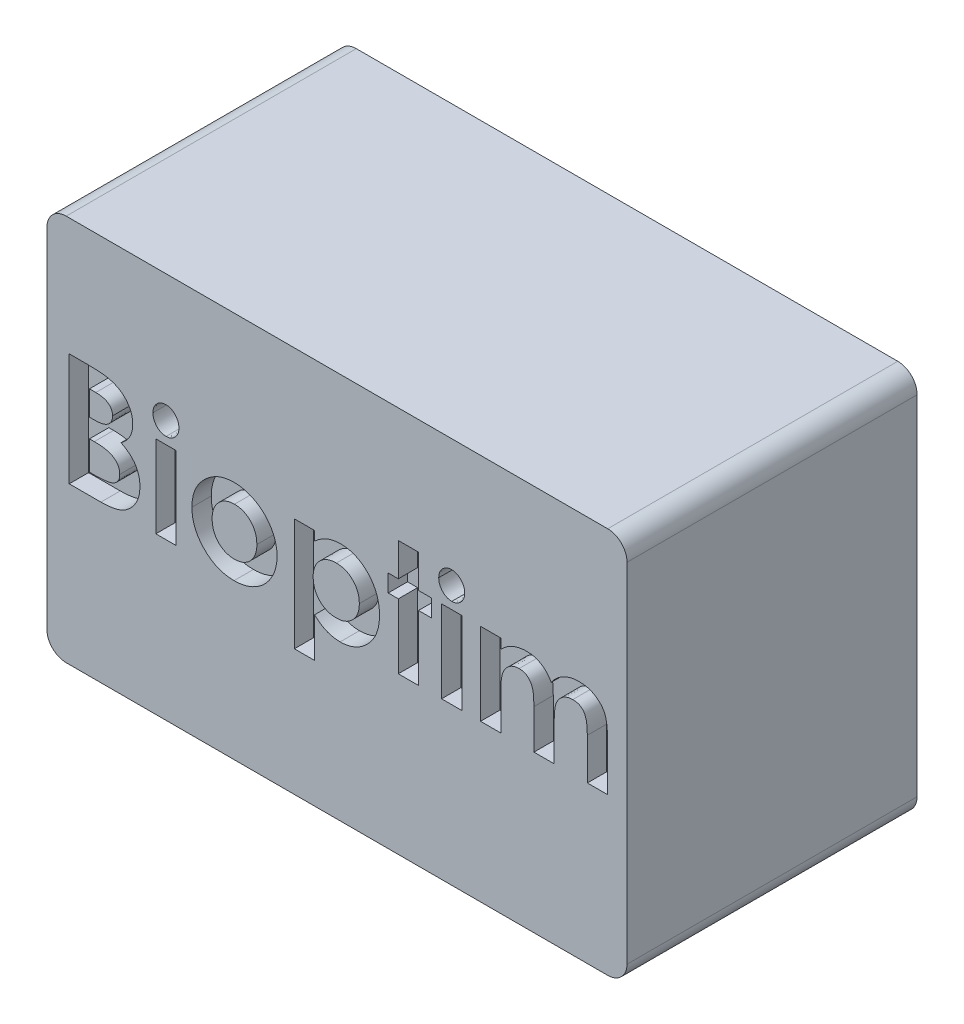
from build123d import *

# Parameters (mm, degrees)
ESQUISSE1_W             = 300
ESQUISSE1_H             = 200
BOSS_EXTRU_1_DEPTH      = 75
ESQUISSE3_W             = 10.447649573
ESQUISSE3_H             = 42.536858974
ESQUISSE3_W_2           = 10.447649572
ENL_V_MAT_EXTRU_1_DEPTH = 10
CONG_1_R                = 10


with BuildPart() as part:
    # Esquisse1 → Boss.-Extru.1 (new, symmetric)
    with BuildSketch(Plane.XY):
        Rectangle(ESQUISSE1_W, ESQUISSE1_H)
    extrude(amount=BOSS_EXTRU_1_DEPTH, both=True)

    # Esquisse3 → Enlèv. mat.-Extru.1 (cut)
    # profile 1 of 9: a face of its own
    with BuildSketch(Plane.XY.offset(75)):
        with BuildLine():
            Line((-138.431356838, -19.095532702), (-138.431356838, 39.112800631))
            Line((-138.431356838, 39.112800631), (-129.103098291, 39.112800631))
            add(Edge.make_bspline(
                [(-129.103098291, 39.112800631), (-128.450061865, 39.112875159), (-127.186448763, 39.113019369), (-125.363384829, 39.048999349), (-123.672646993, 38.966182281), (-122.119615837, 38.87352924), (-120.701647996, 38.713869539), (-119.42089972, 38.545605655), (-118.274812067, 38.342689781), (-117.566248349, 38.160667955), (-117.23288929, 38.075031868)],
                knots=[0, 0, 0, 0, 1.311965854, 2.538629056, 3.664479157, 4.713267157, 5.663616078, 6.530575999, 7.308677837, 8, 8, 8, 8], degree=3))
            add(Edge.make_bspline(
                [(-117.23288929, 38.075031868), (-116.795154999, 37.954240641), (-115.936179796, 37.717209477), (-114.705853187, 37.238514798), (-113.538716777, 36.706411722), (-112.436195609, 36.099381632), (-111.4050596, 35.410095973), (-110.44922742, 34.633084367), (-109.548084132, 33.799536027), (-108.733627279, 32.886220196), (-107.997492476, 31.921132838), (-107.357923314, 30.904526833), (-106.802219686, 29.85194675), (-106.357511227, 28.750146568), (-106.022431758, 27.604200376), (-105.777356032, 26.419001541), (-105.618513776, 25.190799803), (-105.603505266, 24.355214016), (-105.595886752, 23.931059846)],
                knots=[0, 0, 0, 0, 1.099996261, 2.158545794, 3.195537121, 4.207578794, 5.205712374, 6.197378256, 7.190519799, 8.17788031, 9.159561366, 10.129234751, 11.085776129, 12.040971148, 13.00380137, 13.975669004, 14.972423361, 16, 16, 16, 16], degree=3))
            add(Edge.make_bspline(
                [(-105.595886752, 23.931059846), (-105.615806903, 23.386133071), (-105.655017273, 22.313511668), (-105.905495783, 20.738024887), (-106.375182017, 19.248963429), (-106.98975503, 17.818884453), (-107.825382187, 16.453122164), (-108.886467064, 15.152325944), (-110.155823562, 13.876442327), (-111.129490068, 13.111636162), (-111.635934161, 12.713828943)],
                knots=[0, 0, 0, 0, 0.986156485, 1.941127874, 2.875419072, 3.804401753, 4.751181392, 5.761612777, 6.835722519, 8, 8, 8, 8], degree=3))
            add(Edge.make_bspline(
                [(-111.635934161, 12.713828943), (-111.225536164, 12.504324325), (-110.420859235, 12.093543731), (-109.278454396, 11.418343059), (-108.220712219, 10.700181512), (-107.242890107, 9.953508787), (-106.365499, 9.146672347), (-105.552309945, 8.326163216), (-104.843441468, 7.444969631), (-104.209549912, 6.534499011), (-103.658581674, 5.581567635), (-103.178749095, 4.58778479), (-102.773451727, 3.549755498), (-102.430235433, 2.472762486), (-102.174264629, 1.353101403), (-102.007366222, 0.190371812), (-101.87957837, -1.011460789), (-101.869637676, -1.830119144), (-101.864583333, -2.246365701)],
                knots=[0, 0, 0, 0, 1.164658916, 2.283573913, 3.35186032, 4.395461096, 5.390182219, 6.362969632, 7.312859996, 8.245001507, 9.165155236, 10.092416118, 11.032087915, 11.979892451, 12.947605196, 13.931445124, 14.948243989, 16, 16, 16, 16], degree=3))
            add(Edge.make_bspline(
                [(-101.864583333, -2.246365701), (-101.897382637, -3.041372826), (-101.962111932, -4.610316199), (-102.435380953, -6.913885403), (-103.255879055, -9.097877942), (-104.357638814, -11.153613695), (-105.715218817, -13.021582486), (-107.276046511, -14.65790693), (-109.02440794, -16.043019245), (-110.637482675, -16.977862604), (-112.032665291, -17.605229917), (-113.188268984, -17.993107953), (-114.429362856, -18.352437579), (-115.778680765, -18.604766262), (-117.211761418, -18.835725219), (-118.742577442, -18.978324063), (-120.368267769, -19.074959786), (-121.484862159, -19.088536421), (-122.060263088, -19.095532702)],
                knots=[0, 0, 0, 0, 1.284142165, 2.534249414, 3.780121997, 5.041676246, 6.291546858, 7.49970053, 8.684500223, 9.883330709, 10.50184324, 11.153274765, 11.851151195, 12.587658647, 13.369265475, 14.195992086, 15.070362669, 16, 16, 16, 16], degree=3))
            Line((-122.060263088, -19.095532702), (-138.431356838, -19.095532702))
        make_face()
        with BuildLine():
            Line((-127.983707265, 28.665151059), (-127.983707265, 15.978719435))
            Line((-127.983707265, 15.978719435), (-125.208550347, 15.978719435))
            add(Edge.make_bspline(
                [(-125.208550347, 15.978719435), (-124.831381588, 15.982008489), (-124.103280126, 15.988357809), (-123.051614794, 16.07013485), (-122.073735874, 16.20965156), (-121.173352248, 16.404312467), (-120.342076516, 16.651503436), (-119.585219108, 16.948927408), (-118.906107788, 17.311816982), (-118.117137504, 17.852357016), (-117.283139018, 18.647785877), (-116.548979531, 19.796947672), (-116.116564495, 21.118479365), (-116.068405123, 22.050525842), (-116.043536325, 22.531821064)],
                knots=[0, 0, 0, 0, 1.065314748, 2.056525647, 2.977365736, 3.853934255, 4.656397591, 5.425096493, 6.14721249, 6.826394842, 8.123232004, 9.372140726, 10.643011755, 12, 12, 12, 12], degree=3))
            add(Edge.make_bspline(
                [(-116.043536325, 22.531821064), (-116.063435916, 22.982634006), (-116.101910976, 23.854262713), (-116.53729732, 25.078107044), (-117.213538388, 26.162683596), (-118.011936016, 26.90498755), (-118.763782525, 27.411959265), (-119.407559643, 27.745778551), (-120.114153372, 28.044610164), (-120.897242609, 28.273104098), (-121.752355485, 28.444557901), (-122.67533824, 28.570470186), (-123.667783337, 28.656171444), (-124.353267277, 28.66209365), (-124.70715645, 28.665151059)],
                knots=[0, 0, 0, 0, 1.347982417, 2.606269829, 3.849316587, 5.153353503, 5.842674298, 6.568177932, 7.326619318, 8.142485038, 9.012069166, 9.942760135, 10.937925643, 12, 12, 12, 12], degree=3))
            Line((-124.70715645, 28.665151059), (-127.983707265, 28.665151059))
        make_face(mode=Mode.SUBTRACT)
        with BuildLine():
            Line((-127.983707265, 6.277330546), (-127.983707265, -8.647883129))
            Line((-127.983707265, -8.647883129), (-124.975343884, -8.647883129))
            add(Edge.make_bspline(
                [(-124.975343884, -8.647883129), (-124.380586613, -8.644485303), (-123.237091543, -8.637952558), (-121.599036882, -8.559021465), (-120.109635681, -8.416762078), (-118.772834292, -8.239162692), (-117.58658515, -7.998543303), (-116.554898061, -7.692626587), (-115.663624774, -7.356064916), (-114.918109408, -6.940371292), (-114.309066063, -6.456606998), (-113.759468299, -5.962188269), (-113.311360529, -5.391829554), (-112.956809299, -4.770014772), (-112.649945836, -4.112190251), (-112.464867464, -3.39266818), (-112.323955288, -2.632773467), (-112.316200514, -2.107170728), (-112.312232906, -1.83825439)],
                knots=[0, 0, 0, 0, 1.753078804, 3.370512758, 4.83203934, 6.162291463, 7.344201807, 8.395507345, 9.331626367, 10.147333109, 10.898971645, 11.62040215, 12.321813352, 13.025280112, 13.727906689, 14.453419512, 15.208716525, 16, 16, 16, 16], degree=3))
            add(Edge.make_bspline(
                [(-112.312232906, -1.83825439), (-112.32098262, -1.530744327), (-112.338024708, -0.93179745), (-112.477207653, -0.056372668), (-112.730148528, 0.760894451), (-113.048739902, 1.540902529), (-113.492076725, 2.25572456), (-114.018967389, 2.930097824), (-114.655585819, 3.541185961), (-115.371500382, 4.125949865), (-116.20654384, 4.637942344), (-117.161107972, 5.082186509), (-118.240378489, 5.453202875), (-119.447698545, 5.748606349), (-120.777775344, 5.999311195), (-122.240316986, 6.149009663), (-123.823142914, 6.260346993), (-124.920700172, 6.271540726), (-125.488398104, 6.277330546)],
                knots=[0, 0, 0, 0, 0.845221588, 1.646264278, 2.427170338, 3.19324141, 3.95557735, 4.731569926, 5.540061037, 6.376114724, 7.268642756, 8.224665384, 9.265483498, 10.400594375, 11.639216012, 12.983232105, 14.439614077, 16, 16, 16, 16], degree=3))
            Line((-125.488398104, 6.277330546), (-127.983707265, 6.277330546))
        make_face(mode=Mode.SUBTRACT)
    # profile 2 of 9: a face of its own
    with BuildSketch(Plane.XY.offset(75)):
        with BuildLine():
            add(Edge.make_bspline(
                [(-88.455211672, 41.351582683), (-88.004918048, 41.329489573), (-87.120723136, 41.286107624), (-85.853993603, 40.863230125), (-84.691392612, 40.199536526), (-83.663621096, 39.288933089), (-82.808816854, 38.201506032), (-82.155714667, 36.984059143), (-81.791898644, 35.635167201), (-81.741369981, 34.703366756), (-81.715544872, 34.227125217)],
                knots=[0, 0, 0, 0, 0.989868614, 1.943702388, 2.910836514, 3.924849579, 4.949916355, 5.946401046, 6.950409252, 8, 8, 8, 8], degree=3))
            add(Edge.make_bspline(
                [(-81.715544872, 34.227125217), (-81.740446003, 33.754393316), (-81.788967042, 32.833252695), (-82.164088116, 31.502672589), (-82.790977051, 30.285817017), (-83.652704673, 29.214540271), (-84.669333804, 28.318602638), (-85.806531071, 27.642860083), (-87.061121663, 27.243507164), (-87.93159654, 27.196498725), (-88.37358941, 27.172629691)],
                knots=[0, 0, 0, 0, 1.05296456, 2.051751585, 3.055639087, 4.085634717, 5.099016424, 6.062201612, 7.016062274, 8, 8, 8, 8], degree=3))
            add(Edge.make_bspline(
                [(-88.37358941, 27.172629691), (-88.827813723, 27.194643822), (-89.719701096, 27.237869437), (-90.996820421, 27.661736372), (-92.174927535, 28.320202953), (-93.198240586, 29.249411431), (-94.062834245, 30.34456548), (-94.687408672, 31.590355584), (-95.078095426, 32.948471219), (-95.1244696, 33.894072261), (-95.148237179, 34.378709419)],
                knots=[0, 0, 0, 0, 0.989065327, 1.942068821, 2.907541208, 3.917690034, 4.939857478, 5.938239964, 6.943311734, 8, 8, 8, 8], degree=3))
            add(Edge.make_bspline(
                [(-95.148237179, 34.378709419), (-95.122371555, 34.84341405), (-95.07156227, 35.756259213), (-94.705566948, 37.075161334), (-94.067440374, 38.272141036), (-93.218793371, 39.339661722), (-92.200049147, 40.23327898), (-91.038146085, 40.87681577), (-89.779941684, 41.282227225), (-88.901347831, 41.328225488), (-88.455211672, 41.351582683)],
                knots=[0, 0, 0, 0, 1.038616768, 2.040212704, 3.031499824, 4.052181184, 5.074969369, 6.039807101, 7.004644834, 8, 8, 8, 8], degree=3))
        make_face()
    # profile 3 of 9: a face of its own
    with BuildSketch(Plane.XY.offset(75)):
        with Locations((-88.431891026, 2.172896785)):
            Rectangle(ESQUISSE3_W, ESQUISSE3_H)
    # profile 4 of 9: a face of its own
    with BuildSketch(Plane.XY.offset(75)):
        with BuildLine():
            add(Edge.make_bspline(
                [(-53.241035657, 24.187586956), (-52.747090955, 24.178796872), (-51.768856626, 24.161388523), (-50.311898801, 24.016479913), (-48.880411956, 23.78005554), (-47.4661681, 23.473927247), (-46.082299804, 23.04499572), (-44.72154885, 22.53055868), (-43.371748395, 21.939924795), (-42.066400216, 21.236863882), (-40.796074147, 20.474330204), (-39.591729433, 19.63319299), (-38.463367324, 18.720059087), (-37.390041581, 17.756100225), (-36.421770914, 16.69934878), (-35.496677633, 15.600723466), (-34.664742274, 14.420864374), (-33.894489971, 13.188521942), (-33.208739886, 11.910822563), (-32.613292054, 10.59665437), (-32.09649932, 9.264186669), (-31.691860965, 7.89718909), (-31.356857703, 6.513687311), (-31.145446835, 5.096727556), (-30.995148366, 3.660865557), (-30.978295144, 2.694125102), (-30.969818376, 2.207877755)],
                knots=[0, 0, 0, 0, 1.022364134, 2.024744242, 3.027414945, 4.024939316, 5.017584196, 6.023349371, 7.035562955, 8.064994934, 9.090267829, 10.101425541, 11.102933353, 12.093946398, 13.084502048, 14.067315274, 15.065326281, 16.070028806, 17.074376865, 18.064572984, 19.055292013, 20.030201733, 21.013838017, 21.999348303, 22.993720005, 24, 24, 24, 24], degree=3))
            add(Edge.make_bspline(
                [(-30.969818376, 2.207877755), (-30.9787642, 1.7178316), (-30.996550527, 0.743508754), (-31.140009222, -0.705859302), (-31.37733855, -2.129482359), (-31.684641778, -3.535747224), (-32.111968121, -4.906659398), (-32.611253341, -6.262426662), (-33.22414559, -7.584569403), (-33.901743131, -8.887510953), (-34.676947832, -10.132909719), (-35.508163056, -11.324588151), (-36.429381591, -12.431282927), (-37.389900983, -13.48731573), (-38.435280839, -14.456976256), (-39.548834945, -15.356009209), (-40.720923015, -16.195405666), (-41.959973598, -16.955471806), (-43.250116528, -17.623314819), (-44.569593781, -18.225429794), (-45.92612093, -18.726733505), (-47.31689057, -19.135532876), (-48.742746152, -19.452055996), (-50.200539758, -19.667073917), (-51.68713184, -19.816616401), (-52.688739048, -19.83334703), (-53.194394364, -19.841793386)],
                knots=[0, 0, 0, 0, 1.012026251, 2.012137606, 3.004615893, 3.992048833, 4.982446996, 5.968083444, 6.973977695, 7.990229942, 8.999482246, 10.001782172, 10.988562221, 11.971415814, 12.948383116, 13.930088534, 14.925840678, 15.924049238, 16.929462851, 17.924729459, 18.917889337, 19.913673841, 20.916777188, 21.931792057, 22.95587778, 24, 24, 24, 24], degree=3))
            add(Edge.make_bspline(
                [(-53.194394364, -19.841793386), (-53.933765546, -19.820091383), (-55.391077404, -19.777316407), (-57.537353225, -19.484319008), (-59.599215792, -18.979993665), (-61.580024884, -18.276975257), (-63.482353621, -17.376083364), (-65.289599998, -16.261092841), (-67.019741194, -14.953954656), (-68.642809854, -13.465716853), (-70.129760624, -11.83298522), (-71.428791023, -10.090054149), (-72.531772954, -8.263047249), (-73.437714069, -6.349881115), (-74.136915872, -4.347932282), (-74.641858872, -2.263185874), (-74.935214494, -0.089781974), (-74.977627695, 1.38689133), (-74.999198718, 2.137915816)],
                knots=[0, 0, 0, 0, 1.029999031, 2.030143771, 3.011211297, 3.982305373, 4.953580601, 5.938004764, 6.935448627, 7.970290061, 9.001484052, 10.007591832, 10.993831261, 11.969999897, 12.951306496, 13.942897864, 14.953773953, 16, 16, 16, 16], degree=3))
            add(Edge.make_bspline(
                [(-74.999198718, 2.137915816), (-74.976875449, 2.939845333), (-74.932999512, 4.516021743), (-74.584605259, 6.825156103), (-74.028257222, 9.036042818), (-73.229654659, 11.142497337), (-72.209510123, 13.148404731), (-70.964144841, 15.04953432), (-69.48740414, 16.846316731), (-68.35651647, 17.93307233), (-67.781458667, 18.485688919)],
                knots=[0, 0, 0, 0, 1.043912699, 2.05178951, 3.033892, 4.007821512, 4.978932272, 5.95884105, 6.962068106, 8, 8, 8, 8], degree=3))
            add(Edge.make_bspline(
                [(-67.781458667, 18.485688919), (-67.253785651, 18.943745913), (-66.212796025, 19.847397537), (-64.521530499, 20.993531478), (-62.789865443, 21.983441534), (-60.997046109, 22.797331715), (-59.138074578, 23.410991781), (-57.222477024, 23.857681404), (-55.250651769, 24.13205126), (-53.914311904, 24.168980982), (-53.241035657, 24.187586956)],
                knots=[0, 0, 0, 0, 1.048115528, 2.067714963, 3.060638214, 4.039924844, 5.017819947, 5.994373833, 6.98952318, 8, 8, 8, 8], degree=3))
        make_face()
        with BuildLine():
            add(Edge.make_bspline(
                [(-53.007829193, 14.486198067), (-53.412333514, 14.472753683), (-54.208604624, 14.446288269), (-55.380736618, 14.304255458), (-56.489351402, 14.013147017), (-57.556468132, 13.642936751), (-58.563209406, 13.14783268), (-59.537146285, 12.568446821), (-60.427636191, 11.843416715), (-61.277772779, 11.048111731), (-62.049507307, 10.164946889), (-62.707098406, 9.202739455), (-63.294670621, 8.198301468), (-63.740196836, 7.114859202), (-64.108912369, 5.982026279), (-64.358454621, 4.781499563), (-64.532118603, 3.526689594), (-64.545010693, 2.667136163), (-64.551549145, 2.231198401)],
                knots=[0, 0, 0, 0, 1.030650113, 2.02884584, 2.99876339, 3.944280128, 4.900564847, 5.851248946, 6.823638398, 7.81794922, 8.81432732, 9.802856497, 10.78262424, 11.771747962, 12.779760563, 13.812642396, 14.89064281, 16, 16, 16, 16], degree=3))
            add(Edge.make_bspline(
                [(-64.551549145, 2.231198401), (-64.543898267, 1.779887279), (-64.528946096, 0.897886362), (-64.374113225, -0.389953584), (-64.11878872, -1.612105158), (-63.756052616, -2.766680397), (-63.299850716, -3.861966701), (-62.740143888, -4.891818774), (-62.071025053, -5.850044515), (-61.312406698, -6.735463936), (-60.481752001, -7.539168944), (-59.571585521, -8.228878508), (-58.620021606, -8.828144579), (-57.60513106, -9.309447729), (-56.541328233, -9.68105281), (-55.425455137, -9.954653132), (-54.251647858, -10.102055722), (-53.451296798, -10.127445799), (-53.042810163, -10.140404497)],
                knots=[0, 0, 0, 0, 1.141730614, 2.231293227, 3.276944405, 4.297399982, 5.28939179, 6.275415646, 7.257752684, 8.24146775, 9.222424823, 10.176631434, 11.126518621, 12.063689483, 13.012557477, 13.974037417, 14.965980454, 16, 16, 16, 16], degree=3))
            add(Edge.make_bspline(
                [(-53.042810163, -10.140404497), (-52.634119223, -10.128910717), (-51.83284773, -10.106376237), (-50.657662033, -9.937628569), (-49.536090469, -9.672053), (-48.463201934, -9.297249643), (-47.447670833, -8.805644457), (-46.485609622, -8.203511418), (-45.568554927, -7.504208613), (-44.726752762, -6.68533922), (-43.947512598, -5.797158492), (-43.264165581, -4.833874346), (-42.693135043, -3.804022008), (-42.224787751, -2.714081322), (-41.861340559, -1.5655504), (-41.610243001, -0.354160298), (-41.43648617, 0.916334796), (-41.423885648, 1.787497667), (-41.417467949, 2.231198401)],
                knots=[0, 0, 0, 0, 1.031504075, 2.022346795, 2.991027682, 3.937587355, 4.885570121, 5.833146507, 6.798790848, 7.791235734, 8.792807298, 9.778388351, 10.766749885, 11.760164525, 12.768777521, 13.802286646, 14.880660483, 16, 16, 16, 16], degree=3))
            add(Edge.make_bspline(
                [(-41.417467949, 2.231198401), (-41.425216155, 2.67474406), (-41.44042065, 3.545124527), (-41.595264554, 4.817337946), (-41.848083376, 6.024812496), (-42.215497977, 7.162392361), (-42.668988277, 8.243055523), (-43.229081971, 9.261270472), (-43.901500688, 10.212022238), (-44.6638069, 11.090596466), (-45.50691363, 11.883023665), (-46.401277424, 12.58967636), (-47.367349632, 13.174132429), (-48.387006157, 13.655932864), (-49.462959821, 14.026609523), (-50.594002686, 14.301760411), (-51.783601049, 14.447065525), (-52.595488259, 14.473017559), (-53.007829193, 14.486198067)],
                knots=[0, 0, 0, 0, 1.123894411, 2.205445421, 3.243160173, 4.246488011, 5.231014757, 6.210004299, 7.185865357, 8.177612767, 9.153374344, 10.115157457, 11.061423229, 12.009021698, 12.96873347, 13.94135618, 14.954456845, 16, 16, 16, 16], degree=3))
        make_face(mode=Mode.SUBTRACT)
    # profile 5 of 9: a face of its own
    with BuildSketch(Plane.XY.offset(75)):
        with BuildLine():
            Line((-11.567040598, 23.441326272), (-11.567040598, 18.648933444))
            add(Edge.make_bspline(
                [(-11.567040598, 18.648933444), (-11.082002135, 19.094578013), (-10.129436644, 19.96977796), (-8.56982924, 21.090295141), (-6.96709721, 22.052645532), (-5.291792048, 22.826683709), (-3.566905079, 23.43656452), (-1.776980319, 23.865094567), (0.064822632, 24.147721632), (1.316567135, 24.174230259), (1.947273972, 24.187586956)],
                knots=[0, 0, 0, 0, 1.054376801, 2.070687235, 3.070225973, 4.045259405, 5.022040922, 5.996139433, 6.99033025, 8, 8, 8, 8], degree=3))
            add(Edge.make_bspline(
                [(1.947273972, 24.187586956), (2.632419436, 24.171175995), (3.981933687, 24.138851726), (5.967487132, 23.837058244), (7.870281592, 23.349229846), (9.697572916, 22.668088444), (11.439625503, 21.783740093), (13.116012558, 20.724899918), (14.697822811, 19.447874363), (16.185825232, 18.001428801), (17.56226454, 16.416017016), (18.759513249, 14.692337923), (19.75677496, 12.853078447), (20.602003259, 10.919982474), (21.218884822, 8.860990254), (21.694325659, 6.703721786), (21.959267974, 4.429926116), (21.995976644, 2.880929632), (22.014690171, 2.091274523)],
                knots=[0, 0, 0, 0, 0.985987466, 1.942075377, 2.884088208, 3.810275091, 4.743821533, 5.692411115, 6.659945104, 7.665215984, 8.677116751, 9.678438675, 10.680260931, 11.685531812, 12.710472044, 13.769734641, 14.863044265, 16, 16, 16, 16], degree=3))
            add(Edge.make_bspline(
                [(22.014690171, 2.091274523), (21.996979064, 1.328651412), (21.962066568, -0.174646887), (21.67999561, -2.381612494), (21.201908956, -4.489890283), (20.531250269, -6.500239532), (19.678662393, -8.419013294), (18.638020042, -10.244889425), (17.403252927, -11.971490185), (15.991595473, -13.575556514), (14.449154565, -15.02815782), (12.842041697, -16.331429996), (11.138248467, -17.399359343), (9.380365899, -18.301307493), (7.540700678, -18.991009789), (5.631818525, -19.474223766), (3.656742645, -19.797282287), (2.313931611, -19.826808578), (1.632445246, -19.841793386)],
                knots=[0, 0, 0, 0, 1.098553145, 2.165490463, 3.199345634, 4.208780719, 5.21409072, 6.219899742, 7.23156933, 8.267303578, 9.293302409, 10.281606823, 11.243293419, 12.184993323, 13.124258899, 14.066907486, 15.018941492, 16, 16, 16, 16], degree=3))
            add(Edge.make_bspline(
                [(1.632445246, -19.841793386), (1.025162025, -19.827065564), (-0.171149377, -19.798052642), (-1.930297447, -19.539365607), (-3.629654461, -19.152975109), (-5.271468323, -18.571414331), (-6.874195952, -17.79968807), (-8.465133802, -16.838642548), (-10.047960708, -15.664561849), (-11.049816568, -14.758993579), (-11.567040598, -14.29147955)],
                knots=[0, 0, 0, 0, 0.990856396, 1.951927477, 2.896945079, 3.83213376, 4.788585491, 5.796263726, 6.862286081, 8, 8, 8, 8], degree=3))
            Line((-11.567040598, -14.29147955), (-11.567040598, -34.767007061))
            Line((-11.567040598, -34.767007061), (-22.014690171, -34.767007061))
            Line((-22.014690171, -34.767007061), (-22.014690171, 23.441326272))
            Line((-22.014690171, 23.441326272), (-11.567040598, 23.441326272))
        make_face()
        with BuildLine():
            add(Edge.make_bspline(
                [(-0.314828726, 14.486198067), (-0.738825514, 14.473159875), (-1.570089712, 14.447597929), (-2.790536955, 14.301102531), (-3.946932207, 14.025470371), (-5.056857518, 13.668222868), (-6.106258043, 13.185994851), (-7.103719069, 12.601435364), (-8.040697242, 11.9043928), (-8.922055461, 11.122469181), (-9.714025892, 10.24280364), (-10.417622918, 9.302835385), (-11.001350377, 8.290324257), (-11.487950834, 7.21810878), (-11.855069619, 6.074587689), (-12.127365398, 4.86948894), (-12.275340893, 3.599119439), (-12.300447691, 2.732944177), (-12.313301282, 2.289500017)],
                knots=[0, 0, 0, 0, 1.060469436, 2.079096586, 3.066888298, 4.028858836, 4.99004353, 5.948472697, 6.914558426, 7.905691313, 8.889602648, 9.869280844, 10.836099585, 11.806137001, 12.808075328, 13.83377171, 14.890985086, 16, 16, 16, 16], degree=3))
            add(Edge.make_bspline(
                [(-12.313301282, 2.289500017), (-12.300285954, 1.838295222), (-12.274742812, 0.952786385), (-12.128000882, -0.344672043), (-11.857616344, -1.573914487), (-11.482765345, -2.737727955), (-11.004445049, -3.836263443), (-10.421409196, -4.873593382), (-9.710067388, -5.82697485), (-8.926797046, -6.729833376), (-8.039989171, -7.5222193), (-7.107232105, -8.232880472), (-6.106500375, -8.818311312), (-5.052084727, -9.292648672), (-3.951985978, -9.686820421), (-2.789810555, -9.953161865), (-1.570282462, -10.102374087), (-0.73889062, -10.127558745), (-0.314828726, -10.140404497)],
                knots=[0, 0, 0, 0, 1.117193555, 2.192540452, 3.22680955, 4.227918444, 5.21468246, 6.188555072, 7.166222992, 8.154674427, 9.142376254, 10.104580718, 11.053462639, 12.005072638, 12.963662044, 13.941614018, 14.950094269, 16, 16, 16, 16], degree=3))
            add(Edge.make_bspline(
                [(-0.314828726, -10.140404497), (0.093808048, -10.128471185), (0.902674456, -10.104850073), (2.086183043, -9.94003025), (3.223829648, -9.670698276), (4.306704998, -9.286802783), (5.341400978, -8.786971243), (6.33733716, -8.202085611), (7.260130086, -7.47131468), (8.145982459, -6.668135041), (8.938583669, -5.762379407), (9.64964221, -4.800133342), (10.246952515, -3.772808603), (10.72120282, -2.676998432), (11.113279068, -1.533459062), (11.380961892, -0.321259772), (11.528236076, 0.948779696), (11.553977251, 1.814948454), (11.567040598, 2.254519048)],
                knots=[0, 0, 0, 0, 1.021711385, 2.02240246, 2.981887075, 3.941027022, 4.888772411, 5.852236371, 6.822344989, 7.82661704, 8.838806642, 9.826383926, 10.814965113, 11.80282933, 12.807900643, 13.833672313, 14.900613836, 16, 16, 16, 16], degree=3))
            add(Edge.make_bspline(
                [(11.567040598, 2.254519048), (11.553768635, 2.690134987), (11.527619151, 3.54842035), (11.38336083, 4.807883789), (11.105371811, 6.002459786), (10.754375289, 7.141907161), (10.264001686, 8.211393269), (9.684184343, 9.223569967), (9.001921815, 10.181493447), (8.210467887, 11.059304461), (7.342382424, 11.858049421), (6.415715976, 12.564545927), (5.434107649, 13.165975749), (4.384190084, 13.640271286), (3.290739682, 14.030514298), (2.137046242, 14.299318842), (0.928975026, 14.448090315), (0.105340983, 14.473324876), (-0.314828726, 14.486198067)],
                knots=[0, 0, 0, 0, 1.094680664, 2.156827393, 3.177782763, 4.17210342, 5.146667393, 6.126451192, 7.099203661, 8.094961544, 9.09004898, 10.058676268, 11.018205477, 11.974998356, 12.947750825, 13.930643515, 14.944335875, 16, 16, 16, 16], degree=3))
        make_face(mode=Mode.SUBTRACT)
    # profile 6 of 9: a face of its own
    with BuildSketch(Plane.XY.offset(75)):
        Polygon((31.71607906, 40.605321999), (42.163728632, 40.605321999), (42.163728632, 23.441326272), (48.880074786, 23.441326272), (48.880074786, 14.486198067), (42.163728632, 14.486198067), (42.163728632, -19.095532702), (31.71607906, -19.095532702), (31.71607906, 14.486198067), (26.492254274, 14.486198067), (26.492254274, 23.441326272), (31.71607906, 23.441326272), align=None)
    # profile 7 of 9: a face of its own
    with BuildSketch(Plane.XY.offset(75)):
        with BuildLine():
            add(Edge.make_bspline(
                [(59.304403713, 41.351582683), (59.754697336, 41.329489573), (60.638892248, 41.286107624), (61.905621782, 40.863230125), (63.068222773, 40.199536526), (64.095994289, 39.288933089), (64.950798531, 38.201506032), (65.603900718, 36.984059143), (65.96771674, 35.635167201), (66.018245404, 34.703366756), (66.044070513, 34.227125217)],
                knots=[0, 0, 0, 0, 0.989868614, 1.943702388, 2.910836514, 3.924849579, 4.949916355, 5.946401046, 6.950409252, 8, 8, 8, 8], degree=3))
            add(Edge.make_bspline(
                [(66.044070513, 34.227125217), (66.019169382, 33.754393316), (65.970648343, 32.833252695), (65.595527268, 31.502672589), (64.968638333, 30.285817017), (64.106910712, 29.214540271), (63.090281581, 28.318602638), (61.953084314, 27.642860083), (60.698493722, 27.243507164), (59.828018845, 27.196498725), (59.386025975, 27.172629691)],
                knots=[0, 0, 0, 0, 1.05296456, 2.051751585, 3.055639087, 4.085634717, 5.099016424, 6.062201612, 7.016062274, 8, 8, 8, 8], degree=3))
            add(Edge.make_bspline(
                [(59.386025975, 27.172629691), (58.931801662, 27.194643822), (58.039914289, 27.237869437), (56.762794964, 27.661736372), (55.584687849, 28.320202953), (54.561374799, 29.249411431), (53.69678114, 30.34456548), (53.072206713, 31.590355584), (52.681519958, 32.948471219), (52.635145785, 33.894072261), (52.611378205, 34.378709419)],
                knots=[0, 0, 0, 0, 0.989065327, 1.942068821, 2.907541208, 3.917690034, 4.939857478, 5.938239964, 6.943311734, 8, 8, 8, 8], degree=3))
            add(Edge.make_bspline(
                [(52.611378205, 34.378709419), (52.637243829, 34.84341405), (52.688053114, 35.756259213), (53.054048436, 37.075161334), (53.692175011, 38.272141036), (54.540822014, 39.339661722), (55.559566238, 40.23327898), (56.7214693, 40.87681577), (57.979673701, 41.282227225), (58.858267554, 41.328225488), (59.304403713, 41.351582683)],
                knots=[0, 0, 0, 0, 1.038616768, 2.040212704, 3.031499824, 4.052181184, 5.074969369, 6.039807101, 7.004644834, 8, 8, 8, 8], degree=3))
        make_face()
    # profile 8 of 9: a face of its own
    with BuildSketch(Plane.XY.offset(75)):
        with Locations((59.327724359, 2.172896785)):
            Rectangle(ESQUISSE3_W_2, ESQUISSE3_H)
    # profile 9 of 9: a face of its own
    with BuildSketch(Plane.XY.offset(75)):
        with BuildLine():
            Line((74.252938034, 23.441326272), (84.700587607, 23.441326272))
            Line((84.700587607, 23.441326272), (84.700587607, 18.357425364))
            add(Edge.make_bspline(
                [(84.700587607, 18.357425364), (85.165293751, 18.826447408), (86.080261956, 19.749913264), (87.596543255, 20.937111638), (89.178178186, 21.952312921), (90.844333657, 22.774182251), (92.590934319, 23.401738844), (94.409702198, 23.86160306), (96.309979239, 24.132908544), (97.60381107, 24.169158783), (98.26154347, 24.187586956)],
                knots=[0, 0, 0, 0, 1.041528618, 2.050684245, 3.032913108, 4.004406485, 4.976926473, 5.95771665, 6.961784757, 8, 8, 8, 8], degree=3))
            add(Edge.make_bspline(
                [(98.26154347, 24.187586956), (98.920144307, 24.166871027), (100.216578752, 24.12609239), (102.108067587, 23.752929651), (103.89995105, 23.146666292), (105.572514213, 22.282512366), (107.137845383, 21.215327184), (108.526599355, 19.889976603), (109.776644821, 18.359219947), (110.442967175, 17.201951458), (110.784730569, 16.608376887)],
                knots=[0, 0, 0, 0, 1.023965777, 2.015643508, 2.987309376, 3.958410333, 4.93654923, 5.924956801, 6.93568961, 8, 8, 8, 8], degree=3))
            add(Edge.make_bspline(
                [(110.784730569, 16.608376887), (111.224965983, 17.203566208), (112.08902456, 18.37175582), (113.620647091, 19.896959807), (115.276788006, 21.215465385), (117.089489826, 22.290391076), (119.010613466, 23.143716645), (121.031752336, 23.750677049), (123.134582109, 24.125468733), (124.565673168, 24.166708864), (125.29017261, 24.187586956)],
                knots=[0, 0, 0, 0, 1.041189987, 2.043563759, 3.033412161, 4.015238574, 5.00275396, 5.986226558, 6.980513695, 8, 8, 8, 8], degree=3))
            add(Edge.make_bspline(
                [(125.29017261, 24.187586956), (126.038494498, 24.165908276), (127.495781812, 24.123691062), (129.607600395, 23.708347583), (131.585574049, 23.066579588), (133.385990108, 22.132650085), (135.013983537, 21.026373599), (136.401230328, 19.719261768), (137.552518411, 18.256925307), (138.302154588, 16.891459861), (138.786774238, 15.684232044), (139.079391887, 14.633717643), (139.353079925, 13.460685446), (139.549697391, 12.149368254), (139.733231121, 10.712091429), (139.839779668, 9.139299476), (139.91220182, 7.436290761), (139.919893969, 6.257988303), (139.923878205, 5.647673094)],
                knots=[0, 0, 0, 0, 1.321991808, 2.574456155, 3.791773975, 4.987670122, 6.148905103, 7.262530793, 8.344737981, 9.427709016, 10.004683293, 10.642050061, 11.354108788, 12.133887687, 12.985666279, 13.916212488, 14.92067847, 16, 16, 16, 16], degree=3))
            Line((139.923878205, 5.647673094), (139.923878205, -19.095532702))
            Line((139.923878205, -19.095532702), (129.476228632, -19.095532702))
            Line((129.476228632, -19.095532702), (129.476228632, 2.266179371))
            add(Edge.make_bspline(
                [(129.476228632, 2.266179371), (129.467532943, 2.83756546), (129.450842353, 3.93428943), (129.379884225, 5.507330575), (129.221049579, 6.933943149), (129.034875019, 8.222029248), (128.768455637, 9.364759294), (128.443605576, 10.36488798), (128.066781477, 11.223854955), (127.611777735, 11.941570698), (127.102173008, 12.546000719), (126.53531127, 13.064116948), (125.917102912, 13.506172617), (125.241942969, 13.882962252), (124.492143985, 14.137792544), (123.693017988, 14.337741483), (122.838311575, 14.473908141), (122.247367755, 14.482025999), (121.943659856, 14.486198067)],
                knots=[0, 0, 0, 0, 1.669139205, 3.203761885, 4.596586177, 5.860166715, 7.002923539, 8.018877315, 8.928339525, 9.734594377, 10.491888885, 11.231098709, 11.971440889, 12.708030942, 13.480072485, 14.275788656, 15.113863979, 16, 16, 16, 16], degree=3))
            add(Edge.make_bspline(
                [(121.943659856, 14.486198067), (121.475650284, 14.470017763), (120.557274629, 14.438267137), (119.219014123, 14.134854344), (117.959701125, 13.638806903), (116.78405354, 12.963978294), (115.717368696, 12.121130112), (114.784289476, 11.121431802), (114.013696168, 9.959122019), (113.480272696, 8.880731686), (113.14695003, 7.905650136), (112.911821185, 7.070571095), (112.728547595, 6.126220221), (112.585098036, 5.082161602), (112.447474933, 3.932493071), (112.379957811, 2.678668424), (112.31086719, 1.322429524), (112.311766605, 0.385093965), (112.312232906, -0.100866236)],
                knots=[0, 0, 0, 0, 1.129913425, 2.217230253, 3.297175357, 4.391411011, 5.481605898, 6.571841268, 7.681894157, 8.841607612, 9.468549532, 10.170608623, 10.93710061, 11.791434153, 12.717934886, 13.734733707, 14.825576123, 16, 16, 16, 16], degree=3))
            Line((112.312232906, -0.100866236), (112.312232906, -19.095532702))
            Line((112.312232906, -19.095532702), (101.864583333, -19.095532702))
            Line((101.864583333, -19.095532702), (101.864583333, 1.298372547))
            add(Edge.make_bspline(
                [(101.864583333, 1.298372547), (101.863706146, 1.753183485), (101.862018721, 2.62809241), (101.811298098, 3.891477639), (101.744134082, 5.058040645), (101.649977953, 6.131035173), (101.541387399, 7.109126686), (101.384666205, 7.986964342), (101.220016132, 8.769385293), (100.937721354, 9.658192146), (100.539931712, 10.643138884), (99.945628174, 11.687620055), (99.227034025, 12.562126884), (98.402311691, 13.273464896), (97.470340066, 13.815447381), (96.454728894, 14.218614991), (95.336085708, 14.436232492), (94.566086528, 14.469191402), (94.168770032, 14.486198067)],
                knots=[0, 0, 0, 0, 1.256487322, 2.417074606, 3.49288742, 4.484586665, 5.393016842, 6.210437544, 6.947749329, 7.599905853, 8.784490193, 9.876739139, 10.906602197, 11.896672079, 12.869113195, 13.872201355, 14.902064413, 16, 16, 16, 16], degree=3))
            add(Edge.make_bspline(
                [(94.168770032, 14.486198067), (93.71983658, 14.470960488), (92.830720125, 14.440782334), (91.53558618, 14.116644293), (90.29731802, 13.629698392), (89.143156282, 12.936047796), (88.092541109, 12.073364825), (87.168804, 11.04523094), (86.402260454, 9.852865673), (85.866469214, 8.744729472), (85.538006791, 7.745320985), (85.29655567, 6.888558329), (85.120101023, 5.923410722), (84.972876876, 4.860715059), (84.836068552, 3.699216945), (84.768272065, 2.433808565), (84.699249715, 1.065892517), (84.700130893, 0.12079109), (84.700587607, -0.369053669)],
                knots=[0, 0, 0, 0, 1.07893236, 2.136834559, 3.195274846, 4.273923004, 5.364443877, 6.458052972, 7.587287137, 8.767908, 9.410170275, 10.118584836, 10.909717261, 11.770069756, 12.702352573, 13.724628867, 14.820678298, 16, 16, 16, 16], degree=3))
            Line((84.700587607, -0.369053669), (84.700587607, -19.095532702))
            Line((84.700587607, -19.095532702), (74.252938034, -19.095532702))
            Line((74.252938034, -19.095532702), (74.252938034, 23.441326272))
        make_face()
    extrude(amount=-ENL_V_MAT_EXTRU_1_DEPTH, mode=Mode.SUBTRACT)

    # Congé1
    cong_1_edges = [part.edges().sort_by_distance(p)[0] for p in [
        (150, -100, 0),
        (-150, -100, 0),
        (-150, 100, 0),
        (150, 100, 0),
    ]]
    fillet(cong_1_edges, radius=CONG_1_R)


solid = part.part
